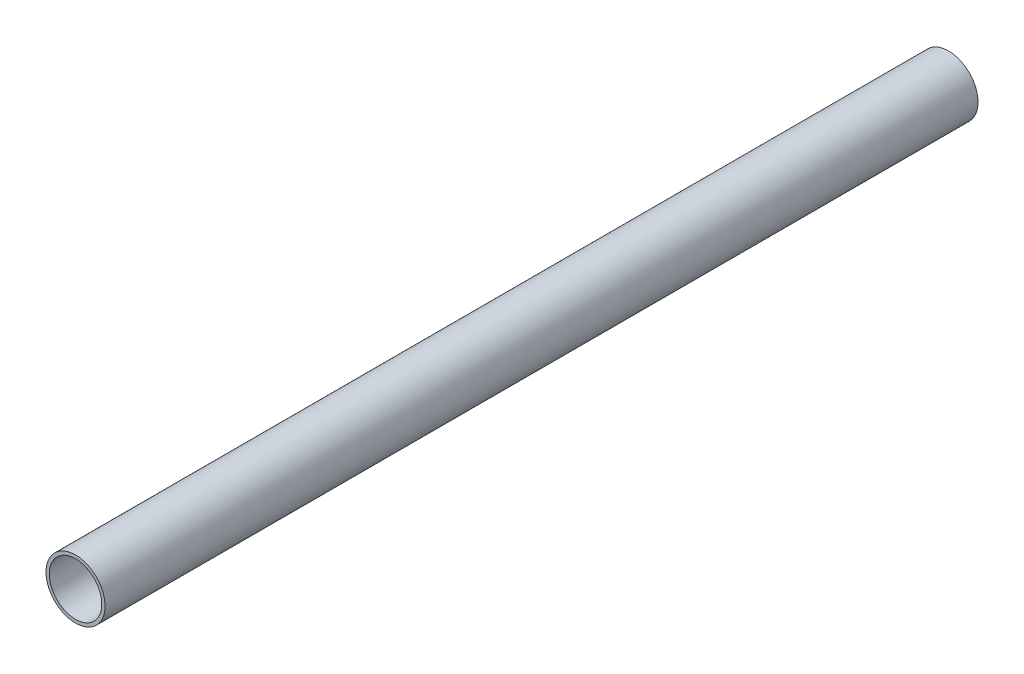
from build123d import *

# Parameters (mm, degrees)
SKETCH1_R           = 9
BOSS_EXTRUDE1_DEPTH = 265.98
SHELL1_T            = -1


with BuildPart() as part:
    # Sketch1 → Boss-Extrude1 (new body)
    with BuildSketch(Plane.XY):
        with Locations(Location((0, 0, 0), (0, 0, 180))):
            Circle(SKETCH1_R)
    extrude(amount=BOSS_EXTRUDE1_DEPTH)

    # Shell1
    shell1_openings = [part.faces().sort_by_distance(p)[0] for p in [
        (0, 0, 265.98),
        (0, 0, 0),
    ]]
    offset(amount=SHELL1_T, openings=shell1_openings, kind=Kind.INTERSECTION)


solid = part.part
